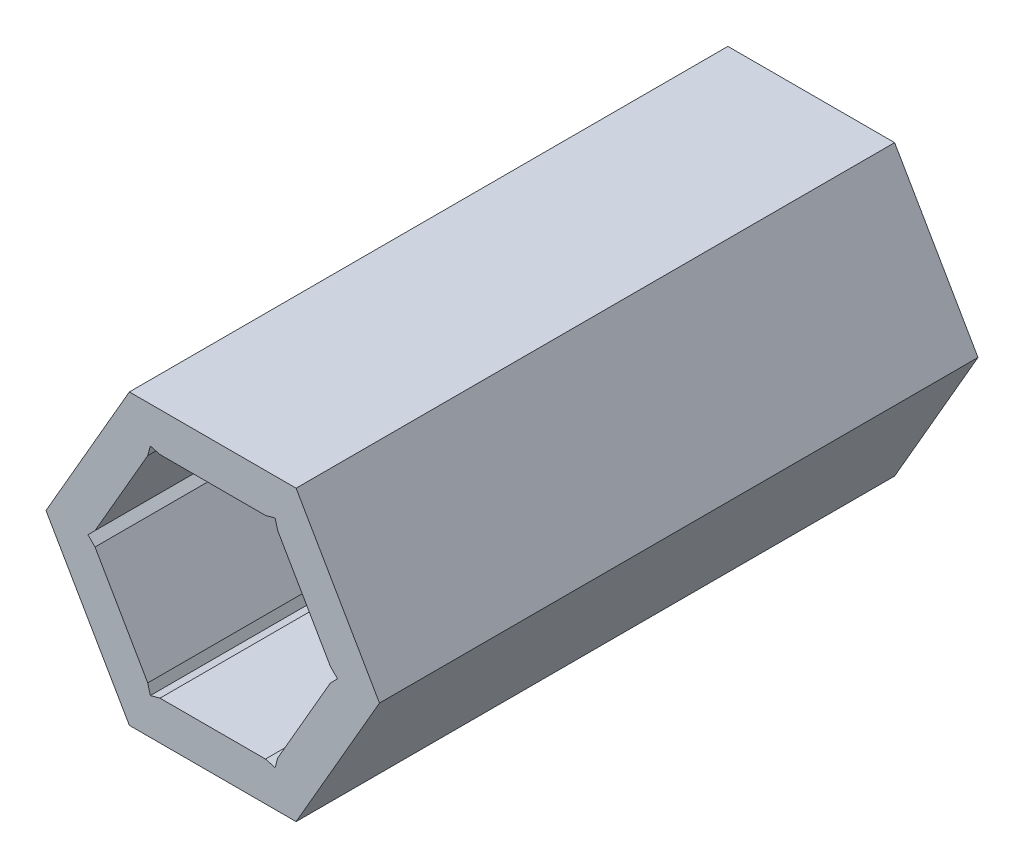
from build123d import *

# Parameters (mm, degrees)
BOTTON_SHAFT_DEPTH = 3.25
SCHIZZO2_R         = 4.5
NUT_BLOCK_DEPTH    = 4
TOP_SHAFT_DEPTH    = 29.5


with BuildPart() as part:
    # Hex-nut-botton → Botton shaft (new, symmetric)
    with BuildSketch(Plane.XY):
        Polygon((11.142860195, 0), (5.571430098, 9.65), (-5.571430098, 9.65), (-11.142860195, 0), (-5.571430098, -9.65), (5.571430098, -9.65), align=None)
        Polygon((7.867433715, 0.473205081), (4.343524479, 6.576794919), (4.170319398, 7.223205081), (3.523909236, 7.05), (-3.523909236, 7.05), (-4.170319398, 7.223205081), (-4.343524479, 6.576794919), (-7.867433715, 0.473205081), (-8.340638796, 0), (-7.867433715, -0.473205081), (-4.343524479, -6.576794919), (-4.170319398, -7.223205081), (-3.523909236, -7.05), (3.523909236, -7.05), (4.170319398, -7.223205081), (4.343524479, -6.576794919), (7.867433715, -0.473205081), (8.340638796, 0), align=None, mode=Mode.SUBTRACT)
    extrude(amount=BOTTON_SHAFT_DEPTH, both=True)

    # Schizzo2 → Nut block (add)
    with BuildSketch(Plane.XY.offset(3.25)):
        Polygon((5.571430098, 9.65), (-5.571430098, 9.65), (-11.142860195, 0), (-5.571430098, -9.65), (5.571430098, -9.65), (11.142860195, 0), align=None)
        Circle(SCHIZZO2_R, mode=Mode.SUBTRACT)
    extrude(amount=NUT_BLOCK_DEPTH)

    # Hex-nut-top → Top shaft (add)
    with BuildSketch(Plane.XY.offset(7.25)):
        Polygon((11.142860195, 0), (5.571430098, 9.65), (-5.571430098, 9.65), (-11.142860195, 0), (-5.571430098, -9.65), (5.571430098, -9.65), align=None)
        Polygon((7.867433715, 0.473205081), (4.343524479, 6.576794919), (4.170319398, 7.223205081), (3.523909236, 7.05), (-3.523909236, 7.05), (-4.170319398, 7.223205081), (-4.343524479, 6.576794919), (-7.867433715, 0.473205081), (-8.340638796, 0), (-7.867433715, -0.473205081), (-4.343524479, -6.576794919), (-4.170319398, -7.223205081), (-3.523909236, -7.05), (3.523909236, -7.05), (4.170319398, -7.223205081), (4.343524479, -6.576794919), (7.867433715, -0.473205081), (8.340638796, 0), align=None, mode=Mode.SUBTRACT)
    extrude(amount=TOP_SHAFT_DEPTH)


solid = part.part
